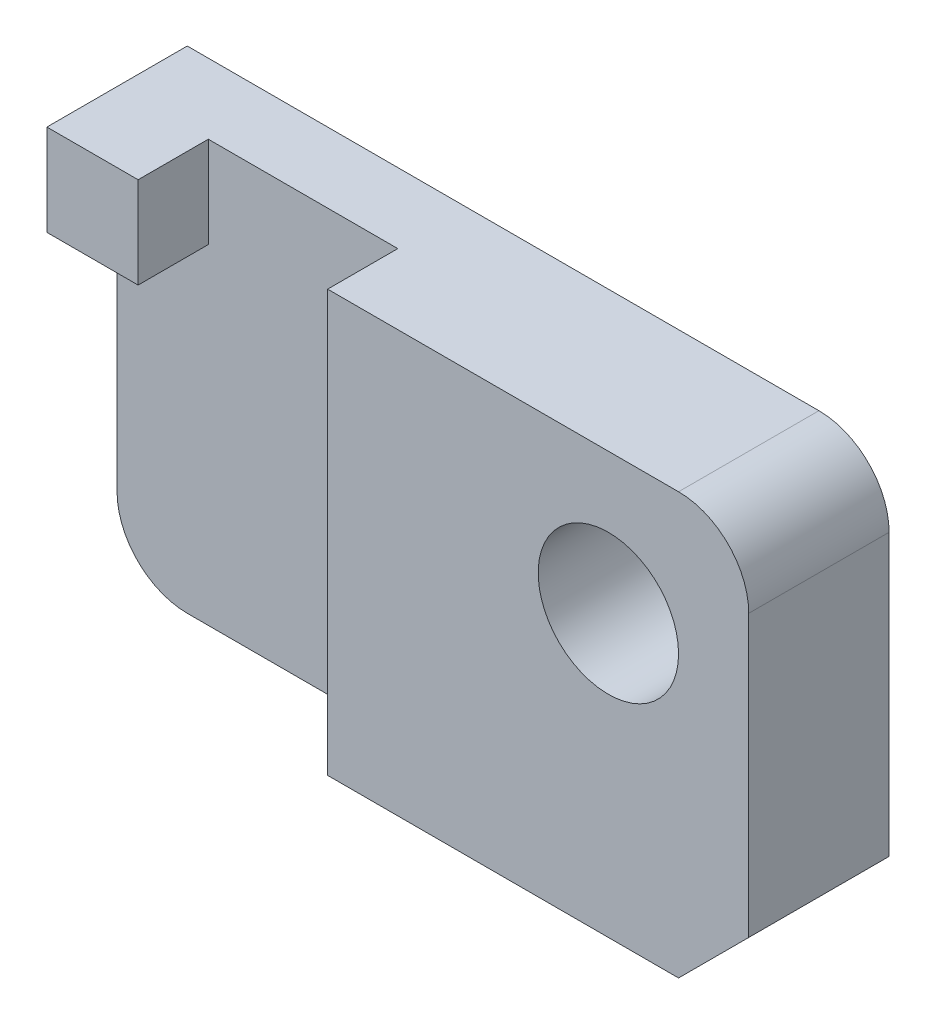
from build123d import *

# Parameters (mm, degrees)
SKETCH1_R           = 12.7
BOSS_EXTRUDE1_DEPTH = 25.4
SKETCH1_4_W         = 16.51
SKETCH1_4_H         = 16.51
BOSS_EXTRUDE2_DEPTH = 25.4
BOSS_EXTRUDE3_DEPTH = 12.7


with BuildPart() as part:
    # Sketch1 → Boss-Extrude1 (new body)
    with BuildSketch(Plane.XY):
        with BuildLine():
            Line((150.843809628, 46.203312203), (87.343809628, 46.203312203))
            Line((87.343809628, 46.203312203), (87.343809628, -29.996687797))
            Line((87.343809628, -29.996687797), (150.843809628, -29.996687797))
            Line((150.843809628, -29.996687797), (163.543809628, -17.296687797))
            Line((163.543809628, -17.296687797), (163.543809628, 33.503312203))
            ThreePointArc((163.543809628, 33.503312203), (159.824065749, 42.483568324), (150.843809628, 46.203312203))
        make_face()
        with Locations((138.143809628, 20.803312203)):
            Circle(SKETCH1_R, mode=Mode.SUBTRACT)
    extrude(amount=BOSS_EXTRUDE1_DEPTH)



with BuildPart() as body_2:
    # Sketch1<4> → Boss-Extrude2 (new body)
    with BuildSketch(Plane.XY):
        with Locations((44.798809628, 37.948312203)):
            Rectangle(SKETCH1_4_W, SKETCH1_4_H)
    extrude(amount=BOSS_EXTRUDE2_DEPTH)


with BuildPart() as part_1:
    add(part.part)

    add(body_2.part)  # Boss-Extrude3 merges body 2
    # Sketch1<5> → Boss-Extrude3 (add)
    with BuildSketch(Plane.XY):
        with BuildLine():
            Line((87.343809628, 46.203312203), (53.053809628, 46.203312203))
            Line((53.053809628, 46.203312203), (53.053809628, 29.693312203))
            Line((53.053809628, 29.693312203), (36.543809628, 29.693312203))
            Line((36.543809628, 29.693312203), (36.543809628, -17.296687797))
            ThreePointArc((36.543809628, -17.296687797), (40.263553507, -26.276943918), (49.243809628, -29.996687797))
            Line((49.243809628, -29.996687797), (87.343809628, -29.996687797))
            Line((87.343809628, -29.996687797), (87.343809628, 46.203312203))
        make_face()
    extrude(amount=BOSS_EXTRUDE3_DEPTH)


solid = part_1.part
